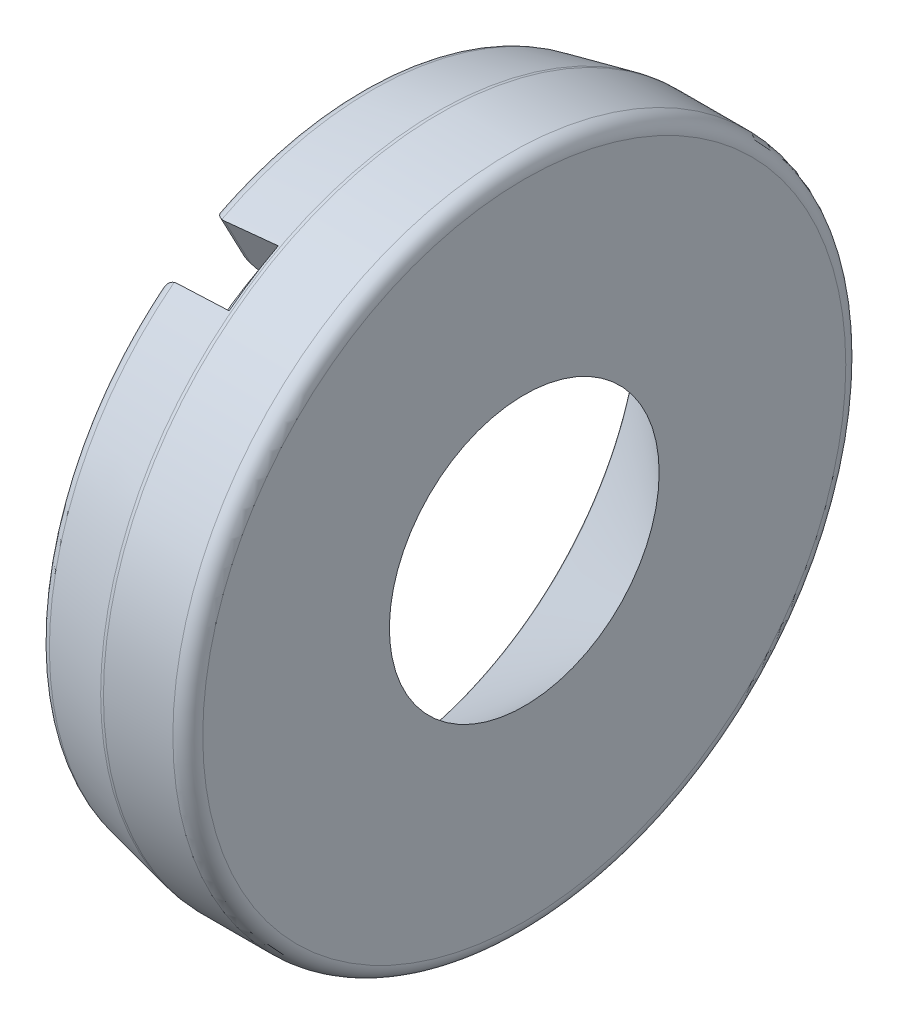
from build123d import *

# Parameters (mm, degrees)
CUT_EXTRUDE_1_DEPTH      = 1
PATTERN_CIRCULAR_1_COUNT = 3
FILLET_1_R               = 0.2


with BuildPart() as part:
    # 草图1 → 旋转1 (revolve)
    with BuildSketch(Plane.XY):
        Polygon((-16.769649529, 1.936980405), (-14.569649529, 0), (-14.569649529, 2.471705001), (-14.569649529, 2.696064574), (-15.719072987, 2.696064574), (-16.769649529, 2.471705001), align=None)
    revolve(axis=Axis((-14.569649529, -1.803935426, 0), (-1, 0, 0)))

    # 草图6 → 切除-拉伸1 (cut)
    with BuildSketch(Plane.ZY.offset(16.769649529)):
        with BuildLine():
            Line((1.629390424, 1.293658293), (2.094930545, 2.17868507))
            ThreePointArc((2.094930545, 2.17868507), (2.434066949, 1.980944769), (2.754678634, 1.754399244))
            Line((2.754678634, 1.754399244), (2.142527827, 0.963658206))
            ThreePointArc((2.142527827, 0.963658206), (1.893163183, 1.139860281), (1.629390424, 1.293658293))
        make_face()
    cut_extrude_1 = extrude(amount=-CUT_EXTRUDE_1_DEPTH, mode=Mode.SUBTRACT)

    # 阵列(圆周)1: 切除-拉伸1 ×3 about axis
    pattern_circular_1_axis = Axis((-16.769649529, -1.803935426, 0), (1, 0, 0))
    for i in range(1, PATTERN_CIRCULAR_1_COUNT):
        add(cut_extrude_1.rotate(pattern_circular_1_axis, i * 360 / PATTERN_CIRCULAR_1_COUNT), mode=Mode.SUBTRACT)

    # 圆角1
    fillet_1_edges = [part.edges().sort_by_distance(p)[0] for p in [
        (-15.719072987, -6.303935426, 0),
        (-14.569649529, -6.303935426, 0),
        (-16.769649529, 1.365574581, 2.453670694),
        (-16.769649529, -2.008713628, 4.270733771),
        (-16.769649529, -5.193667937, 2.139160363),
        (-16.769649529, -1.983103443, 3.736622817),
        (-16.769649529, 1.743498047, 1.866014286),
        (-16.769649529, 1.013905087, -2.460533703),
        (-16.769649529, -1.263749276, -3.971711531),
        (-16.769649529, 1.416685768, -2.812241132),
        (-16.769649529, -5.513631583, 1.518040837),
        (-16.769649529, -5.400110263, -2.312710011),
        (-16.769649529, -1.961636387, -4.005174649),
        (-16.769649529, -4.950361701, -2.023475463),
    ]]
    fillet(fillet_1_edges, radius=FILLET_1_R)


solid = part.part
